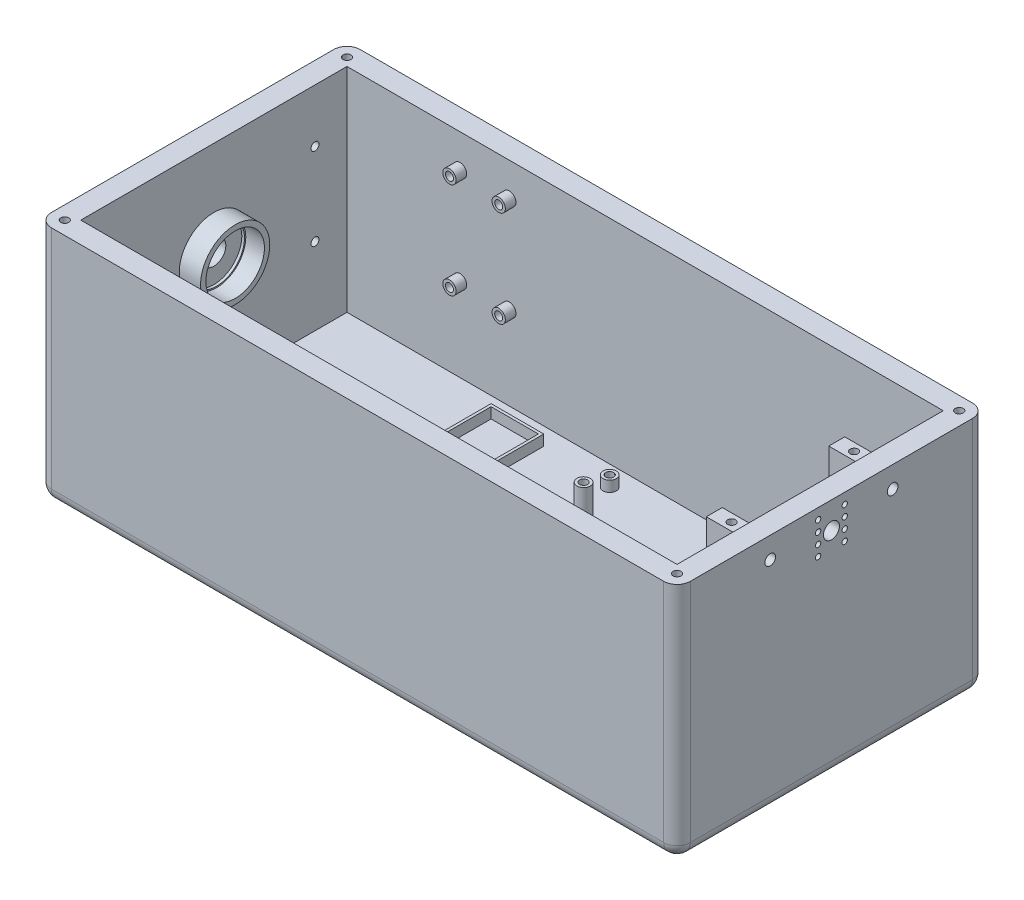
from build123d import *

# Parameters (mm, degrees)
SKETCH1_W                      = 240
SKETCH1_H                      = 116
BOSS_EXTRUDE1_DEPTH            = 10
SKETCH2_W                      = 62.15
SKETCH2_H                      = 62.15
CUT_EXTRUDE1_DEPTH             = 2.5
CUT_EXTRUDE2_REACH             = 135.493
SKETCH3_R                      = 1.5
SKETCH4_W                      = 12
SKETCH4_H                      = 15.5
CUT_EXTRUDE3_DEPTH             = 2.5
CUT_EXTRUDE4_REACH             = 135.493
SKETCH6_R                      = 1.5
CUT_EXTRUDE4_DIRECTION_2_DEPTH = 134.492509153
CUT_EXTRUDE5_REACH             = 135.493
SKETCH7_W                      = 6
SKETCH7_H                      = 15.5
SKETCH8_R                      = 2.5
SKETCH8_R_2                    = 1.5
SKETCH8_R_3                    = 2.347298944
BOSS_EXTRUDE2_DEPTH            = 15
SKETCH9_R                      = 2.5
SKETCH9_R_2                    = 1.5
SKETCH9_W                      = 19.78
SKETCH9_H                      = 34.766
SKETCH9_W_2                    = 17.78
SKETCH9_H_2                    = 32.766
BOSS_EXTRUDE3_DEPTH            = 4
SKETCH10_W                     = 240
SKETCH10_H                     = 116
SKETCH10_W_2                   = 224
SKETCH10_H_2                   = 100
BOSS_EXTRUDE4_DEPTH            = 80
CUT_EXTRUDE14_REACH            = 257.515
SKETCH24_R                     = 1.5
SKETCH14_R                     = 13
SKETCH14_R_2                   = 11
BOSS_EXTRUDE6_DEPTH            = 8
SKETCH16_R                     = 11
SKETCH16_R_2                   = 10.5
BOSS_EXTRUDE7_DEPTH            = 1
CUT_EXTRUDE9_REACH             = 257.515
SKETCH17_R                     = 4.5
SKETCH18_R                     = 2.5
SKETCH18_R_2                   = 1.5
BOSS_EXTRUDE8_DEPTH            = 4
FILLET1_R                      = 5
SKETCH19_R                     = 1.5
CUT_EXTRUDE10_DEPTH            = 20
CUT_EXTRUDE11_REACH            = 264.8
SKETCH20_R                     = 2
SKETCH21_W                     = 6
SKETCH21_H                     = 10
SKETCH21_R                     = 2
BOSS_EXTRUDE9_DEPTH            = 13
CUT_EXTRUDE12_REACH            = 161.163
SKETCH22_R                     = 1.5
CUT_EXTRUDE13_REACH            = 264.8
SKETCH23_R                     = 1
SKETCH23_R_2                   = 3


with BuildPart() as part:
    # Sketch1 → Boss-Extrude1 (new body)
    with BuildSketch(Plane(origin=(0, 0, 0), x_dir=(1, 0, 0), z_dir=(0, 1, 0))):
        Rectangle(SKETCH1_W, SKETCH1_H)
    extrude(amount=BOSS_EXTRUDE1_DEPTH)

    # Sketch2 → Cut-Extrude1 (cut)
    with BuildSketch(Plane.XZ):
        Rectangle(SKETCH2_W, SKETCH2_H)
    extrude(amount=-CUT_EXTRUDE1_DEPTH, mode=Mode.SUBTRACT)

    # Sketch3 → Cut-Extrude2 (cut, up to next)
    with BuildSketch(Plane.XZ.offset(-2.5), mode=Mode.PRIVATE) as cut_extrude2_sk1:
        with Locations(Location((-26.075, 26.075, 0), (0, 0, 270))):
            Circle(SKETCH3_R)
    cut_extrude2_tool1 = extrude(cut_extrude2_sk1.sketch, amount=-CUT_EXTRUDE2_REACH, mode=Mode.PRIVATE) & part.part
    # Sketch3 → Cut-Extrude2 (cut, up to next)
    with BuildSketch(Plane.XZ.offset(-2.5), mode=Mode.PRIVATE) as cut_extrude2_sk2:
        with Locations(Location((-26.075, -26.075, 0), (0, 0, 90))):
            Circle(SKETCH3_R)
    cut_extrude2_tool2 = extrude(cut_extrude2_sk2.sketch, amount=-CUT_EXTRUDE2_REACH, mode=Mode.PRIVATE) & part.part
    # Sketch3 → Cut-Extrude2 (cut, up to next)
    with BuildSketch(Plane.XZ.offset(-2.5), mode=Mode.PRIVATE) as cut_extrude2_sk3:
        with Locations(Location((26.075, -26.075, 0), (0, 0, 270))):
            Circle(SKETCH3_R)
    cut_extrude2_tool3 = extrude(cut_extrude2_sk3.sketch, amount=-CUT_EXTRUDE2_REACH, mode=Mode.PRIVATE) & part.part
    # Sketch3 → Cut-Extrude2 (cut, up to next)
    with BuildSketch(Plane.XZ.offset(-2.5), mode=Mode.PRIVATE) as cut_extrude2_sk4:
        with Locations(Location((26.075, 26.075, 0), (0, 0, 90))):
            Circle(SKETCH3_R)
    cut_extrude2_tool4 = extrude(cut_extrude2_sk4.sketch, amount=-CUT_EXTRUDE2_REACH, mode=Mode.PRIVATE) & part.part
    add(cut_extrude2_tool1.solids().sort_by_distance((-26.075, 2.5, 26.075))[0], mode=Mode.SUBTRACT)
    add(cut_extrude2_tool2.solids().sort_by_distance((-26.075, 2.5, -26.075))[0], mode=Mode.SUBTRACT)
    add(cut_extrude2_tool3.solids().sort_by_distance((26.075, 2.5, -26.075))[0], mode=Mode.SUBTRACT)
    add(cut_extrude2_tool4.solids().sort_by_distance((26.075, 2.5, 26.075))[0], mode=Mode.SUBTRACT)

    # Sketch4 → Cut-Extrude3 (cut)
    with BuildSketch(Plane.XZ):
        with Locations((54, 0)):
            Rectangle(SKETCH4_W, SKETCH4_H)
    extrude(amount=-CUT_EXTRUDE3_DEPTH, mode=Mode.SUBTRACT)

    # Sketch6 → Cut-Extrude4 (cut, up to next)
    with BuildSketch(Plane.XZ.offset(-2.5), mode=Mode.PRIVATE) as cut_extrude4_sk1:
        with Locations(Location((58, 5.75, 0), (0, 0, 90))):
            Circle(SKETCH6_R)
    cut_extrude4_tool1 = extrude(cut_extrude4_sk1.sketch, amount=-CUT_EXTRUDE4_REACH, mode=Mode.PRIVATE) & part.part
    # Sketch6 → Cut-Extrude4 (cut, up to next)
    with BuildSketch(Plane.XZ.offset(-2.5), mode=Mode.PRIVATE) as cut_extrude4_sk2:
        with Locations(Location((58, -5.75, 0), (0, 0, 90))):
            Circle(SKETCH6_R)
    cut_extrude4_tool2 = extrude(cut_extrude4_sk2.sketch, amount=-CUT_EXTRUDE4_REACH, mode=Mode.PRIVATE) & part.part
    add(cut_extrude4_tool1.solids().sort_by_distance((58, 2.5, 5.75))[0], mode=Mode.SUBTRACT)
    add(cut_extrude4_tool2.solids().sort_by_distance((58, 2.5, -5.75))[0], mode=Mode.SUBTRACT)

    # Sketch6 → Cut-Extrude4 direction 2 (cut)
    with BuildSketch(Plane.XZ.offset(-2.5)):
        with Locations(Location((58, 5.75, 0), (0, 0, 90))):
            Circle(SKETCH6_R)
        with Locations(Location((58, -5.75, 0), (0, 0, 90))):
            Circle(SKETCH6_R)
    extrude(amount=CUT_EXTRUDE4_DIRECTION_2_DEPTH, mode=Mode.SUBTRACT)

    # Sketch7 → Cut-Extrude5 (cut, up to next)
    with BuildSketch(Plane.XZ.offset(-2.5), mode=Mode.PRIVATE) as cut_extrude5_sk1:
        with Locations((51, 0)):
            Rectangle(SKETCH7_W, SKETCH7_H)
    cut_extrude5_tool1 = extrude(cut_extrude5_sk1.sketch, amount=-CUT_EXTRUDE5_REACH, mode=Mode.PRIVATE) & part.part
    add(cut_extrude5_tool1.solids().sort_by_distance((51, 2.5, 0))[0], mode=Mode.SUBTRACT)

    # Sketch8 → Boss-Extrude2 (add)
    # profile 1 of 4: a face of its own
    with BuildSketch(Plane(origin=(0, 10, 0), x_dir=(1, 0, 0), z_dir=(0, 1, 0))):
        with Locations(Location((86.5, 24.2, 0), (0, 0, 270))):
            Circle(SKETCH8_R)
        with Locations(Location((86.5, 24.2, 0), (0, 0, 270))):
            Circle(SKETCH8_R_2, mode=Mode.SUBTRACT)
    # profile 2 of 4: a face of its own
    with BuildSketch(Plane(origin=(0, 10, 0), x_dir=(1, 0, 0), z_dir=(0, 1, 0))):
        with Locations(Location((84.5, -24.2, 0), (0, 0, 270))):
            Circle(SKETCH8_R_3)
        with Locations(Location((84.5, -24.2, 0), (0, 0, 270))):
            Circle(SKETCH8_R_2, mode=Mode.SUBTRACT)
    # profile 3 of 4: a face of its own
    with BuildSketch(Plane(origin=(0, 10, 0), x_dir=(1, 0, 0), z_dir=(0, 1, 0))):
        with Locations(Location((9.7, -24.2, 0), (0, 0, 270))):
            Circle(SKETCH8_R)
        with Locations(Location((9.7, -24.2, 0), (0, 0, 270))):
            Circle(SKETCH8_R_2, mode=Mode.SUBTRACT)
    # profile 4 of 4: a face of its own
    with BuildSketch(Plane(origin=(0, 10, 0), x_dir=(1, 0, 0), z_dir=(0, 1, 0))):
        with Locations(Location((2.7, 24.2, 0), (0, 0, 270))):
            Circle(SKETCH8_R)
        with Locations(Location((2.7, 24.2, 0), (0, 0, 270))):
            Circle(SKETCH8_R_2, mode=Mode.SUBTRACT)
    extrude(amount=BOSS_EXTRUDE2_DEPTH)

    # Sketch9 → Boss-Extrude3 (add)
    # profile 1 of 5: a face of its own
    with BuildSketch(Plane(origin=(0, 10, 0), x_dir=(1, 0, 0), z_dir=(0, 1, 0))):
        with Locations(Location((-24.1, 15.8, 0), (0, 0, 270))):
            Circle(SKETCH9_R)
        with Locations(Location((-24.1, 15.8, 0), (0, 0, 270))):
            Circle(SKETCH9_R_2, mode=Mode.SUBTRACT)
    # profile 2 of 5: a face of its own
    with BuildSketch(Plane(origin=(0, 10, 0), x_dir=(1, 0, 0), z_dir=(0, 1, 0))):
        with Locations(Location((-5.8, 15.8, 0), (0, 0, 270))):
            Circle(SKETCH9_R)
        with Locations(Location((-5.8, 15.8, 0), (0, 0, 270))):
            Circle(SKETCH9_R_2, mode=Mode.SUBTRACT)
    # profile 3 of 5: a face of its own
    with BuildSketch(Plane(origin=(0, 10, 0), x_dir=(1, 0, 0), z_dir=(0, 1, 0))):
        with Locations(Location((-5.8, 42.5, 0), (0, 0, 270))):
            Circle(SKETCH9_R)
        with Locations(Location((-5.8, 42.5, 0), (0, 0, 270))):
            Circle(SKETCH9_R_2, mode=Mode.SUBTRACT)
    # profile 4 of 5: a face of its own
    with BuildSketch(Plane(origin=(0, 10, 0), x_dir=(1, 0, 0), z_dir=(0, 1, 0))):
        Polygon((-17.7, -47), (-17.7, -48), (-22.7, -48), (-22.7, -22.8), (-3.3, -22.8), (-3.3, -48), (-8.3, -48), (-8.3, -47), (-4.3, -47), (-4.3, -23.8), (-21.7, -23.8), (-21.7, -47), align=None)
    # profile 5 of 5: a face of its own
    with BuildSketch(Plane(origin=(0, 10, 0), x_dir=(1, 0, 0), z_dir=(0, 1, 0))):
        with Locations((-41.35, 26)):
            Rectangle(SKETCH9_W, SKETCH9_H)
        with Locations((-41.35, 26)):
            Rectangle(SKETCH9_W_2, SKETCH9_H_2, mode=Mode.SUBTRACT)
    extrude(amount=BOSS_EXTRUDE3_DEPTH)

    # Sketch10 → Boss-Extrude4 (add)
    with BuildSketch(Plane(origin=(0, 10, 0), x_dir=(1, 0, 0), z_dir=(0, 1, 0))):
        Rectangle(SKETCH10_W, SKETCH10_H)
        Rectangle(SKETCH10_W_2, SKETCH10_H_2, mode=Mode.SUBTRACT)
    extrude(amount=BOSS_EXTRUDE4_DEPTH)

    # Sketch24 → Cut-Extrude14 (cut, up to next)
    with BuildSketch(Plane(origin=(-112, 0, 0), x_dir=(0, 0, -1), z_dir=(1, 0, 0)), mode=Mode.PRIVATE) as cut_extrude14_sk1:
        with Locations((-38, 70)):
            Circle(SKETCH24_R)
    cut_extrude14_tool1 = extrude(cut_extrude14_sk1.sketch, amount=-CUT_EXTRUDE14_REACH, mode=Mode.PRIVATE) & part.part
    # Sketch24 → Cut-Extrude14 (cut, up to next)
    with BuildSketch(Plane(origin=(-112, 0, 0), x_dir=(0, 0, -1), z_dir=(1, 0, 0)), mode=Mode.PRIVATE) as cut_extrude14_sk2:
        with Locations((-38, 39)):
            Circle(SKETCH24_R)
    cut_extrude14_tool2 = extrude(cut_extrude14_sk2.sketch, amount=-CUT_EXTRUDE14_REACH, mode=Mode.PRIVATE) & part.part
    # Sketch24 → Cut-Extrude14 (cut, up to next)
    with BuildSketch(Plane(origin=(-112, 0, 0), x_dir=(0, 0, -1), z_dir=(1, 0, 0)), mode=Mode.PRIVATE) as cut_extrude14_sk3:
        with Locations((38, 39)):
            Circle(SKETCH24_R)
    cut_extrude14_tool3 = extrude(cut_extrude14_sk3.sketch, amount=-CUT_EXTRUDE14_REACH, mode=Mode.PRIVATE) & part.part
    # Sketch24 → Cut-Extrude14 (cut, up to next)
    with BuildSketch(Plane(origin=(-112, 0, 0), x_dir=(0, 0, -1), z_dir=(1, 0, 0)), mode=Mode.PRIVATE) as cut_extrude14_sk4:
        with Locations((38, 70)):
            Circle(SKETCH24_R)
    cut_extrude14_tool4 = extrude(cut_extrude14_sk4.sketch, amount=-CUT_EXTRUDE14_REACH, mode=Mode.PRIVATE) & part.part
    add(cut_extrude14_tool1.solids().sort_by_distance((-112, 70, 38))[0], mode=Mode.SUBTRACT)
    add(cut_extrude14_tool2.solids().sort_by_distance((-112, 39, 38))[0], mode=Mode.SUBTRACT)
    add(cut_extrude14_tool3.solids().sort_by_distance((-112, 39, -38))[0], mode=Mode.SUBTRACT)
    add(cut_extrude14_tool4.solids().sort_by_distance((-112, 70, -38))[0], mode=Mode.SUBTRACT)

    # Sketch14 → Boss-Extrude6 (add)
    with BuildSketch(Plane(origin=(-112, 0, 0), x_dir=(0, 0, -1), z_dir=(1, 0, 0))):
        with Locations((0, 54.5)):
            Circle(SKETCH14_R)
        with Locations((0, 54.5)):
            Circle(SKETCH14_R_2, mode=Mode.SUBTRACT)
    extrude(amount=BOSS_EXTRUDE6_DEPTH)

    # Sketch16 → Boss-Extrude7 (add)
    with BuildSketch(Plane(origin=(-112, 0, 0), x_dir=(0, 0, -1), z_dir=(1, 0, 0))):
        with Locations((0, 54.5)):
            Circle(SKETCH16_R)
        with Locations((0, 54.5)):
            Circle(SKETCH16_R_2, mode=Mode.SUBTRACT)
    extrude(amount=BOSS_EXTRUDE7_DEPTH)

    # Sketch17 → Cut-Extrude9 (cut, up to next)
    with BuildSketch(Plane(origin=(-112, 0, 0), x_dir=(0, 0, -1), z_dir=(1, 0, 0)), mode=Mode.PRIVATE) as cut_extrude9_sk1:
        with Locations((0, 54.5)):
            Circle(SKETCH17_R)
    cut_extrude9_tool1 = extrude(cut_extrude9_sk1.sketch, amount=-CUT_EXTRUDE9_REACH, mode=Mode.PRIVATE) & part.part
    add(cut_extrude9_tool1.solids().sort_by_distance((-112, 54.5, 0))[0], mode=Mode.SUBTRACT)

    # Sketch18 → Boss-Extrude8 (add)
    # profile 1 of 4: a face of its own
    with BuildSketch(Plane.XY.offset(-50)):
        with Locations((-69.5, 77.5)):
            Circle(SKETCH18_R)
        with Locations((-69.5, 77.5)):
            Circle(SKETCH18_R_2, mode=Mode.SUBTRACT)
    # profile 2 of 4: a face of its own
    with BuildSketch(Plane.XY.offset(-50)):
        with Locations(Location((-69.5, 41.351210886, 0), (0, 0, 180))):
            Circle(SKETCH18_R)
        with Locations(Location((-69.5, 41.351210886, 0), (0, 0, 180))):
            Circle(SKETCH18_R_2, mode=Mode.SUBTRACT)
    # profile 3 of 4: a face of its own
    with BuildSketch(Plane.XY.offset(-50)):
        with Locations((-51, 41.351210886)):
            Circle(SKETCH18_R)
        with Locations((-51, 41.351210886)):
            Circle(SKETCH18_R_2, mode=Mode.SUBTRACT)
    # profile 4 of 4: a face of its own
    with BuildSketch(Plane.XY.offset(-50)):
        with Locations(Location((-51, 77.5, 0), (0, 0, 180))):
            Circle(SKETCH18_R)
        with Locations(Location((-51, 77.5, 0), (0, 0, 180))):
            Circle(SKETCH18_R_2, mode=Mode.SUBTRACT)
    extrude(amount=BOSS_EXTRUDE8_DEPTH)

    # Fillet1
    fillet1_edges = [part.edges().sort_by_distance(p)[0] for p in [
        (0, 0, 58),
        (-120, 0, 0),
        (0, 0, -58),
        (120, 0, 0),
        (120, 45, 58),
        (-120, 45, 58),
        (-120, 45, -58),
        (120, 45, -58),
    ]]
    fillet(fillet1_edges, radius=FILLET1_R)

    # Sketch19 → Cut-Extrude10 (cut)
    with BuildSketch(Plane(origin=(0, 90, 0), x_dir=(1, 0, 0), z_dir=(0, 1, 0))):
        with Locations(Location((115, 53, 0), (0, 0, 270))):
            Circle(SKETCH19_R)
        with Locations(Location((-115, 53, 0), (0, 0, 270))):
            Circle(SKETCH19_R)
        with Locations(Location((-115, -53, 0), (0, 0, 270))):
            Circle(SKETCH19_R)
        with Locations(Location((115, -53, 0), (0, 0, 270))):
            Circle(SKETCH19_R)
    extrude(amount=-CUT_EXTRUDE10_DEPTH, mode=Mode.SUBTRACT)

    # Sketch20 → Cut-Extrude11 (cut, up to next)
    with BuildSketch(Plane(origin=(120, 0, 0), x_dir=(0, 0, -1), z_dir=(1, 0, 0)), mode=Mode.PRIVATE) as cut_extrude11_sk1:
        with Locations((-23, 82)):
            Circle(SKETCH20_R)
    cut_extrude11_tool1 = extrude(cut_extrude11_sk1.sketch, amount=-CUT_EXTRUDE11_REACH, mode=Mode.PRIVATE) & part.part
    # Sketch20 → Cut-Extrude11 (cut, up to next)
    with BuildSketch(Plane(origin=(120, 0, 0), x_dir=(0, 0, -1), z_dir=(1, 0, 0)), mode=Mode.PRIVATE) as cut_extrude11_sk2:
        with Locations(Location((23, 82, 0), (0, 0, 180))):
            Circle(SKETCH20_R)
    cut_extrude11_tool2 = extrude(cut_extrude11_sk2.sketch, amount=-CUT_EXTRUDE11_REACH, mode=Mode.PRIVATE) & part.part
    add(cut_extrude11_tool1.solids().sort_by_distance((120, 82, 23))[0], mode=Mode.SUBTRACT)
    add(cut_extrude11_tool2.solids().sort_by_distance((120, 82, -23))[0], mode=Mode.SUBTRACT)

    # Sketch21 → Boss-Extrude9 (add)
    # profile 1 of 2: a face of its own
    with BuildSketch(Plane.ZY.offset(-112)):
        with Locations((-23, 82)):
            Rectangle(SKETCH21_W, SKETCH21_H)
        with Locations((-23, 82)):
            Circle(SKETCH21_R, mode=Mode.SUBTRACT)
    # profile 2 of 2: a face of its own
    with BuildSketch(Plane.ZY.offset(-112)):
        with Locations((23, 82)):
            Rectangle(SKETCH21_W, SKETCH21_H)
        with Locations(Location((23, 82, 0), (0, 0, 180))):
            Circle(SKETCH21_R, mode=Mode.SUBTRACT)
    extrude(amount=BOSS_EXTRUDE9_DEPTH)

    # Sketch22 → Cut-Extrude12 (cut, up to next)
    with BuildSketch(Plane(origin=(0, 87, 0), x_dir=(1, 0, 0), z_dir=(0, 1, 0)), mode=Mode.PRIVATE) as cut_extrude12_sk1:
        with Locations(Location((105.5, -23, 0), (0, 0, 270))):
            Circle(SKETCH22_R)
    cut_extrude12_tool1 = extrude(cut_extrude12_sk1.sketch, amount=-CUT_EXTRUDE12_REACH, mode=Mode.PRIVATE) & part.part
    # Sketch22 → Cut-Extrude12 (cut, up to next)
    with BuildSketch(Plane(origin=(0, 87, 0), x_dir=(1, 0, 0), z_dir=(0, 1, 0)), mode=Mode.PRIVATE) as cut_extrude12_sk2:
        with Locations(Location((105.5, 23, 0), (0, 0, 270))):
            Circle(SKETCH22_R)
    cut_extrude12_tool2 = extrude(cut_extrude12_sk2.sketch, amount=-CUT_EXTRUDE12_REACH, mode=Mode.PRIVATE) & part.part
    add(cut_extrude12_tool1.solids().sort_by_distance((105.5, 87, 23))[0], mode=Mode.SUBTRACT)
    add(cut_extrude12_tool2.solids().sort_by_distance((105.5, 87, -23))[0], mode=Mode.SUBTRACT)

    # Sketch23 → Cut-Extrude13 (cut, up to next)
    with BuildSketch(Plane(origin=(120, 0, 0), x_dir=(0, 0, -1), z_dir=(1, 0, 0)), mode=Mode.PRIVATE) as cut_extrude13_sk1:
        with Locations((5, 78)):
            Circle(SKETCH23_R)
    cut_extrude13_tool1 = extrude(cut_extrude13_sk1.sketch, amount=-CUT_EXTRUDE13_REACH, mode=Mode.PRIVATE) & part.part
    # Sketch23 → Cut-Extrude13 (cut, up to next)
    with BuildSketch(Plane(origin=(120, 0, 0), x_dir=(0, 0, -1), z_dir=(1, 0, 0)), mode=Mode.PRIVATE) as cut_extrude13_sk2:
        with Locations((-5, 78)):
            Circle(SKETCH23_R)
    cut_extrude13_tool2 = extrude(cut_extrude13_sk2.sketch, amount=-CUT_EXTRUDE13_REACH, mode=Mode.PRIVATE) & part.part
    # Sketch23 → Cut-Extrude13 (cut, up to next)
    with BuildSketch(Plane(origin=(120, 0, 0), x_dir=(0, 0, -1), z_dir=(1, 0, 0)), mode=Mode.PRIVATE) as cut_extrude13_sk3:
        with Locations((5, 74)):
            Circle(SKETCH23_R)
    cut_extrude13_tool3 = extrude(cut_extrude13_sk3.sketch, amount=-CUT_EXTRUDE13_REACH, mode=Mode.PRIVATE) & part.part
    # Sketch23 → Cut-Extrude13 (cut, up to next)
    with BuildSketch(Plane(origin=(120, 0, 0), x_dir=(0, 0, -1), z_dir=(1, 0, 0)), mode=Mode.PRIVATE) as cut_extrude13_sk4:
        with Locations((-5, 74)):
            Circle(SKETCH23_R)
    cut_extrude13_tool4 = extrude(cut_extrude13_sk4.sketch, amount=-CUT_EXTRUDE13_REACH, mode=Mode.PRIVATE) & part.part
    # Sketch23 → Cut-Extrude13 (cut, up to next)
    with BuildSketch(Plane(origin=(120, 0, 0), x_dir=(0, 0, -1), z_dir=(1, 0, 0)), mode=Mode.PRIVATE) as cut_extrude13_sk5:
        with Locations(Location((-5, 86, 0), (0, 0, 180))):
            Circle(SKETCH23_R)
    cut_extrude13_tool5 = extrude(cut_extrude13_sk5.sketch, amount=-CUT_EXTRUDE13_REACH, mode=Mode.PRIVATE) & part.part
    # Sketch23 → Cut-Extrude13 (cut, up to next)
    with BuildSketch(Plane(origin=(120, 0, 0), x_dir=(0, 0, -1), z_dir=(1, 0, 0)), mode=Mode.PRIVATE) as cut_extrude13_sk6:
        with Locations(Location((5, 86, 0), (0, 0, 180))):
            Circle(SKETCH23_R)
    cut_extrude13_tool6 = extrude(cut_extrude13_sk6.sketch, amount=-CUT_EXTRUDE13_REACH, mode=Mode.PRIVATE) & part.part
    # Sketch23 → Cut-Extrude13 (cut, up to next)
    with BuildSketch(Plane(origin=(120, 0, 0), x_dir=(0, 0, -1), z_dir=(1, 0, 0)), mode=Mode.PRIVATE) as cut_extrude13_sk7:
        with Locations(Location((-5, 82, 0), (0, 0, 180))):
            Circle(SKETCH23_R)
    cut_extrude13_tool7 = extrude(cut_extrude13_sk7.sketch, amount=-CUT_EXTRUDE13_REACH, mode=Mode.PRIVATE) & part.part
    # Sketch23 → Cut-Extrude13 (cut, up to next)
    with BuildSketch(Plane(origin=(120, 0, 0), x_dir=(0, 0, -1), z_dir=(1, 0, 0)), mode=Mode.PRIVATE) as cut_extrude13_sk8:
        with Locations(Location((5, 82, 0), (0, 0, 180))):
            Circle(SKETCH23_R)
    cut_extrude13_tool8 = extrude(cut_extrude13_sk8.sketch, amount=-CUT_EXTRUDE13_REACH, mode=Mode.PRIVATE) & part.part
    # Sketch23 → Cut-Extrude13 (cut, up to next)
    with BuildSketch(Plane(origin=(120, 0, 0), x_dir=(0, 0, -1), z_dir=(1, 0, 0)), mode=Mode.PRIVATE) as cut_extrude13_sk9:
        with Locations((0, 80)):
            Circle(SKETCH23_R_2)
    cut_extrude13_tool9 = extrude(cut_extrude13_sk9.sketch, amount=-CUT_EXTRUDE13_REACH, mode=Mode.PRIVATE) & part.part
    add(cut_extrude13_tool1.solids().sort_by_distance((120, 78, -5))[0], mode=Mode.SUBTRACT)
    add(cut_extrude13_tool2.solids().sort_by_distance((120, 78, 5))[0], mode=Mode.SUBTRACT)
    add(cut_extrude13_tool3.solids().sort_by_distance((120, 74, -5))[0], mode=Mode.SUBTRACT)
    add(cut_extrude13_tool4.solids().sort_by_distance((120, 74, 5))[0], mode=Mode.SUBTRACT)
    add(cut_extrude13_tool5.solids().sort_by_distance((120, 86, 5))[0], mode=Mode.SUBTRACT)
    add(cut_extrude13_tool6.solids().sort_by_distance((120, 86, -5))[0], mode=Mode.SUBTRACT)
    add(cut_extrude13_tool7.solids().sort_by_distance((120, 82, 5))[0], mode=Mode.SUBTRACT)
    add(cut_extrude13_tool8.solids().sort_by_distance((120, 82, -5))[0], mode=Mode.SUBTRACT)
    add(cut_extrude13_tool9.solids().sort_by_distance((120, 80, 0))[0], mode=Mode.SUBTRACT)


solid = part.part
